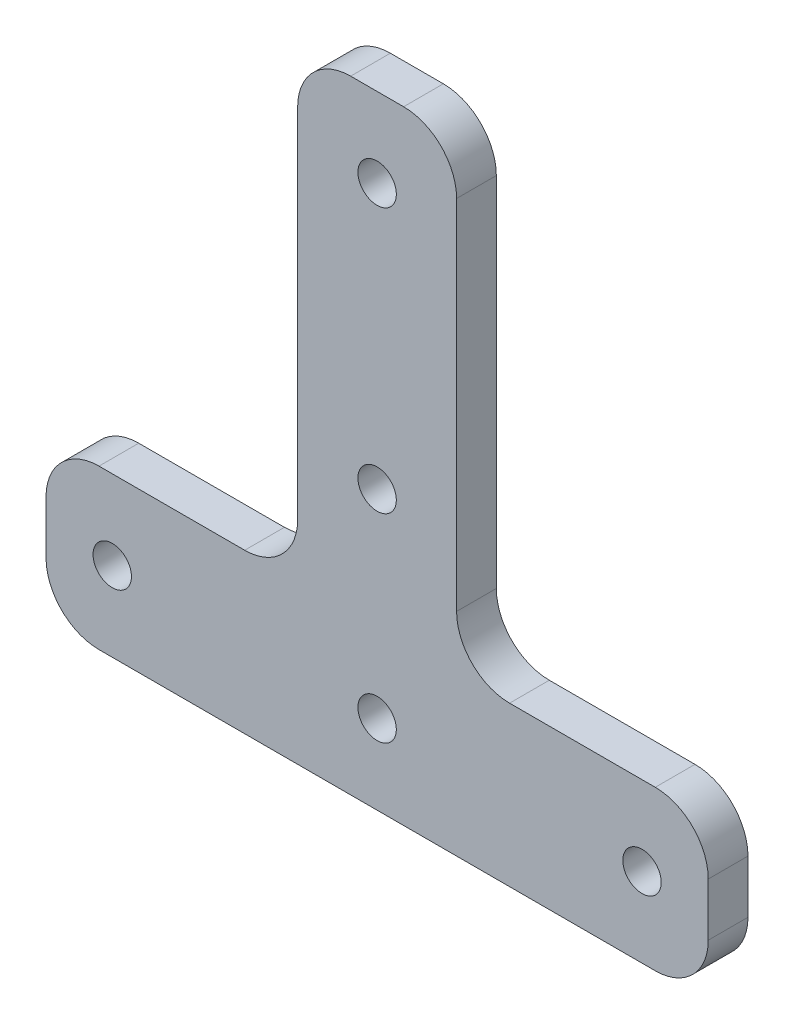
from build123d import *

# Parameters (mm, degrees)
SKETCH_1_R      = 1.45
EXTRUDE_1_DEPTH = 3
FILLET_1_R      = 4


with BuildPart() as part:
    # 草图1 → 凸台-拉伸1 (new body)
    with BuildSketch(Plane.XY):
        Polygon((-6, 6), (-25, 6), (-25, -6), (25, -6), (25, 6), (6, 6), (6, 41), (-6, 41), align=None)
        with Locations((0, 35)):
            Circle(SKETCH_1_R, mode=Mode.SUBTRACT)
        Circle(SKETCH_1_R, mode=Mode.SUBTRACT)
        with Locations((-20, 0)):
            Circle(SKETCH_1_R, mode=Mode.SUBTRACT)
        with Locations((20, 0)):
            Circle(SKETCH_1_R, mode=Mode.SUBTRACT)
        with Locations((0, 15)):
            Circle(SKETCH_1_R, mode=Mode.SUBTRACT)
    extrude(amount=EXTRUDE_1_DEPTH)

    # 圆角1
    fillet_1_edges = [part.edges().sort_by_distance(p)[0] for p in [
        (-6, 41, 1.5),
        (6, 41, 1.5),
        (6, 6, 1.5),
        (25, 6, 1.5),
        (25, -6, 1.5),
        (-25, -6, 1.5),
        (-25, 6, 1.5),
        (-6, 6, 1.5),
    ]]
    fillet(fillet_1_edges, radius=FILLET_1_R)


solid = part.part
